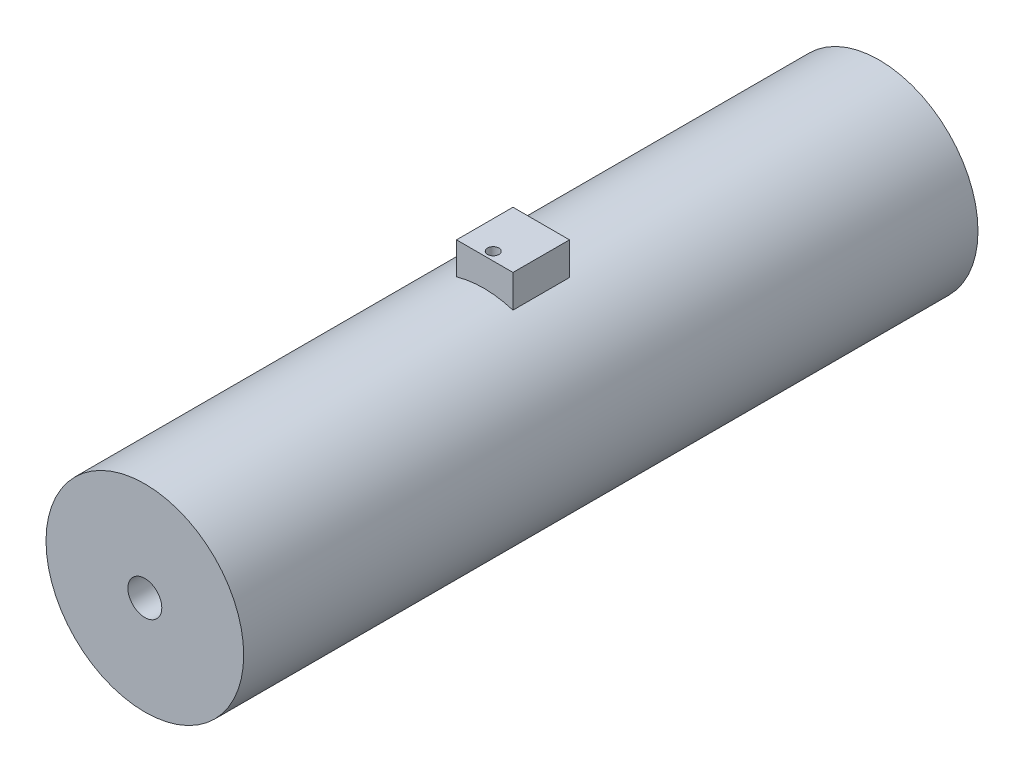
from build123d import *

# Parameters (mm, degrees)
BOSS_EXTRUDE2_DEPTH      = 65
BOSS_EXTRUDE2_DEPTH_BACK = 65
SKETCH1_R                = 17.5
BOSS_EXTRUDE3_DEPTH      = 5
BOSS_EXTRUDE3_DEPTH_BACK = 5
SKETCH3_R                = 3
CUT_EXTRUDE1_DEPTH       = 15
SKETCH4_R                = 1
CUT_EXTRUDE2_DEPTH       = 10


with BuildPart() as part:
    # Sketch1 → Boss-Extrude2 (new, two sides: drawn at the far end of the back side and taken through both)
    with BuildSketch(Plane.XY.offset(-BOSS_EXTRUDE2_DEPTH_BACK)):
        Circle(SKETCH1_R)
    extrude(amount=BOSS_EXTRUDE2_DEPTH + BOSS_EXTRUDE2_DEPTH_BACK)

    # Sketch2 → Boss-Extrude3 (add, two sides: drawn at the far end of the back side and taken through both)
    with BuildSketch(Plane.XY.offset(-BOSS_EXTRUDE3_DEPTH_BACK)):
        Polygon((5.175667468, 22.49911829), (-4.824332532, 22.49911829), (-4.824332532, 12.49911829), (0, 12.49911829), (5.175667468, 12.49911829), align=None)
    extrude(amount=BOSS_EXTRUDE3_DEPTH + BOSS_EXTRUDE3_DEPTH_BACK)

    # Sketch3 → Cut-Extrude1 (cut)
    with BuildSketch(Plane.XY.offset(65)):
        Circle(SKETCH3_R)
    cut_extrude1 = extrude(amount=-CUT_EXTRUDE1_DEPTH, mode=Mode.SUBTRACT)

    # Mirror1: Cut-Extrude1 across plane
    add(cut_extrude1.mirror(Plane.XY), mode=Mode.SUBTRACT)

    # Sketch4 → Cut-Extrude2 (cut)
    with BuildSketch(Plane(origin=(0, 22.49911829, 0), x_dir=(1, 0, 0), z_dir=(0, 1, 0))):
        with Locations((0.175667468, -3.5)):
            Circle(SKETCH4_R)
    extrude(amount=-CUT_EXTRUDE2_DEPTH, mode=Mode.SUBTRACT)


solid = part.part
